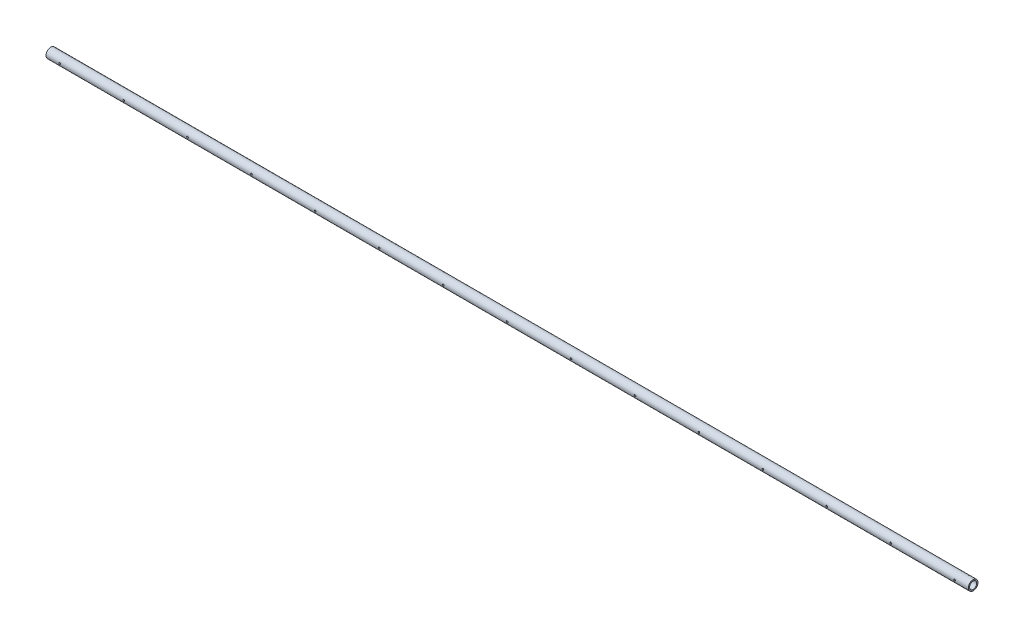
from build123d import *

# Parameters (mm, degrees)
SKETCH1_R           = 10.65
SKETCH1_R_2         = 7.88
BOSS_EXTRUDE1_DEPTH = 2020
SKETCH2_R           = 1.85
CUT_EXTRUDE1_DEPTH  = 40
LPATTERN1_COUNT     = 15
LPATTERN1_PITCH     = 140


with BuildPart() as part:
    # Sketch1 → Boss-Extrude1 (new body)
    with BuildSketch(Plane(origin=(0, 0, 0), x_dir=(0, 0, -1), z_dir=(1, 0, 0))):
        Circle(SKETCH1_R)
        Circle(SKETCH1_R_2, mode=Mode.SUBTRACT)
    extrude(amount=BOSS_EXTRUDE1_DEPTH)

    # Sketch2 → Cut-Extrude1 (cut)
    with BuildSketch(Plane.XY):
        with Locations((1990, 0)):
            Circle(SKETCH2_R)
    cut_extrude1 = extrude(amount=CUT_EXTRUDE1_DEPTH, mode=Mode.SUBTRACT)

    # LPattern1: Cut-Extrude1 ×15
    with Locations(*[(-i * LPATTERN1_PITCH, 0, 0) for i in range(1, LPATTERN1_COUNT)]):
        add(cut_extrude1, mode=Mode.SUBTRACT)


solid = part.part
